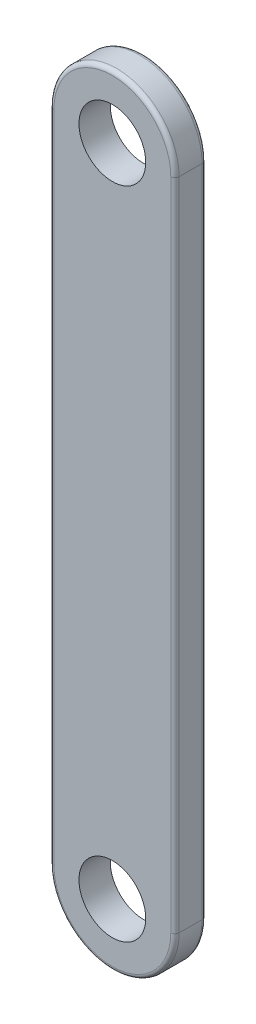
from build123d import *

# Parameters (mm, degrees)
SKETCH1_R           = 1.6
BOSS_EXTRUDE1_DEPTH = 1.5
FILLET1_R           = 0.2


with BuildPart() as part:
    # Sketch1 → Boss-Extrude1 (new body)
    with BuildSketch(Plane.XY):
        with BuildLine():
            Line((-3, 0), (-3, -31.38))
            ThreePointArc((-3, -31.38), (0, -34.38), (3, -31.38))
            Line((3, -31.38), (3, 0))
            ThreePointArc((3, 0), (0, 3), (-3, 0))
        make_face()
        Circle(SKETCH1_R, mode=Mode.SUBTRACT)
        with Locations((0, -31.38)):
            Circle(SKETCH1_R, mode=Mode.SUBTRACT)
    extrude(amount=BOSS_EXTRUDE1_DEPTH)

    # Fillet1
    fillet1_edges = [part.edges().sort_by_distance(p)[0] for p in [
        (0, -34.38, 1.5),
        (3, -15.69, 1.5),
        (0, 3, 1.5),
        (3, -15.69, 0),
        (0, -34.38, 0),
        (-3, -15.69, 0),
        (0, 3, 0),
        (-3, -15.69, 1.5),
    ]]
    fillet(fillet1_edges, radius=FILLET1_R)


solid = part.part
